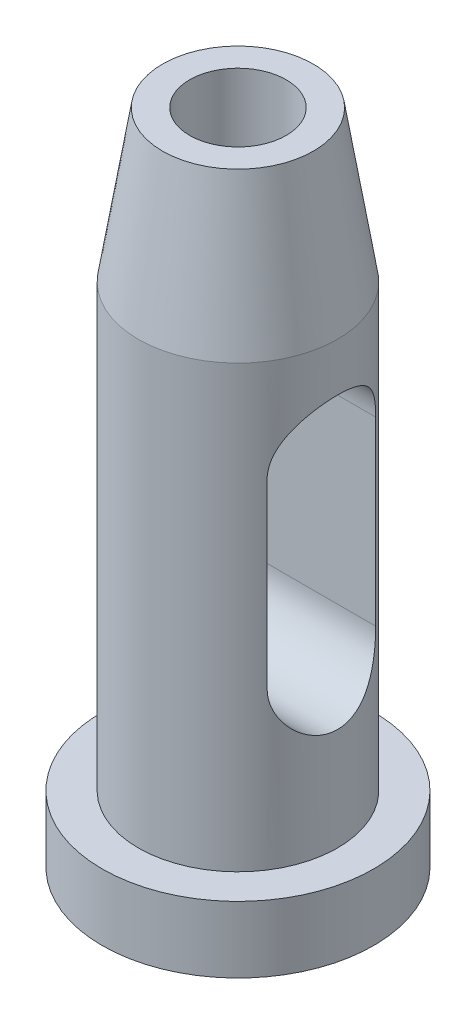
from build123d import *

# Parameters (mm, degrees)
CUT_EXTRUDE1_DEPTH         = 114.549548656
CUT_EXTRUDE1_DEPTH_BACK    = 114.549548656
F_16_0MM_DOWEL_HOLE1_D     = 16
F_16_0MM_DOWEL_HOLE1_DEPTH = 32.693115048
F_16_0MM_DOWEL_HOLE1_TIP   = 4.806884952


with BuildPart() as part:
    # Sketch1 → Revolve1 (revolve)
    with BuildSketch(Plane(origin=(0, 0, 0), x_dir=(0, 0, -1), z_dir=(1, 0, 0))):
        Polygon((0, 0), (-22.5, 0), (-22.5, 11), (-16.5, 11), (-16.5, 84), (-12.5, 109), (0, 109), align=None)
    revolve(axis=Axis((0, 109, 0), (0, -1, 0)))

    # Sketch2 → Cut-Extrude1 (cut, two sides: drawn at the far end of the back side and taken through both)
    with BuildSketch(Plane(origin=(0, 0, 0), x_dir=(0, 0, -1), z_dir=(1, 0, 0)).offset(-CUT_EXTRUDE1_DEPTH_BACK)):
        with BuildLine():
            Line((-9, 37), (-9, 67))
            ThreePointArc((-9, 67), (0, 76), (9, 67))
            Line((9, 67), (9, 37))
            ThreePointArc((9, 37), (0, 28), (-9, 37))
        make_face()
    extrude(amount=CUT_EXTRUDE1_DEPTH + CUT_EXTRUDE1_DEPTH_BACK, mode=Mode.SUBTRACT)

    # Ø16.0mm Dowel Hole1
    with Locations(Plane.ZX.offset(109)):
        with Locations((0, 0)):
            Hole(F_16_0MM_DOWEL_HOLE1_D / 2, depth=F_16_0MM_DOWEL_HOLE1_DEPTH)
            with Locations((0, 0, -(F_16_0MM_DOWEL_HOLE1_DEPTH + F_16_0MM_DOWEL_HOLE1_TIP / 2))):  # 118° drill point
                Cone(0, F_16_0MM_DOWEL_HOLE1_D / 2, F_16_0MM_DOWEL_HOLE1_TIP, mode=Mode.SUBTRACT)


solid = part.part
